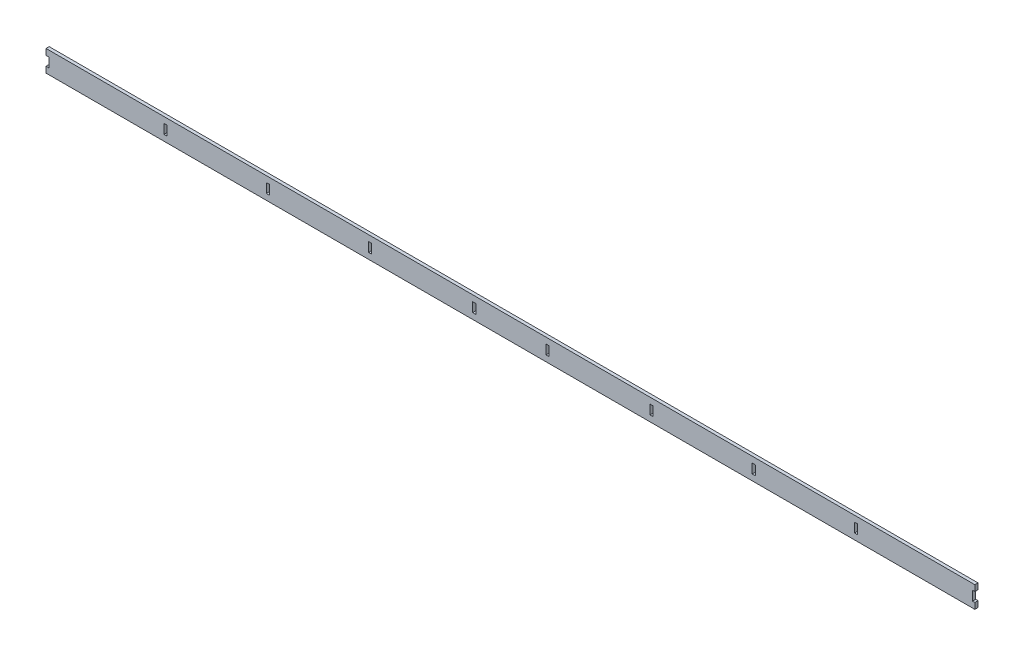
from build123d import *

# Parameters (mm, degrees)
EXTRUDE_1_DEPTH = 2


with BuildPart() as part:
    # Model → 凸台-拉伸1 (new body)
    with BuildSketch(Plane.XY):
        Polygon((587.364408917, 20.936416671), (-2.931829291, 20.936416671), (-2.931829291, 17.136416671), (-0.931829291, 17.136416671), (-0.931829291, 11.136416671), (-2.931829291, 11.136416671), (-2.931829291, 7.336416671), (587.364408917, 7.336416671), (587.364408917, 11.136416671), (585.864408917, 11.136416671), (585.864408917, 17.136416671), (587.364408917, 17.136416671), align=None)
        Polygon((72.06814754, 14.136416671), (72.06814754, 17.136416671), (74.06814754, 17.136416671), (74.06814754, 11.136416671), (72.06814754, 11.136416671), align=None, mode=Mode.SUBTRACT)
        Polygon((137.068124371, 14.136416671), (137.068123187, 17.136422392), (139.068123187, 17.136422392), (139.068123187, 11.136422392), (137.068123187, 11.136422392), align=None, mode=Mode.SUBTRACT)
        Polygon((202.068101203, 14.136416671), (202.068100018, 17.136422392), (204.068100018, 17.136422392), (204.068100018, 11.136422392), (202.068100018, 11.136422392), align=None, mode=Mode.SUBTRACT)
        Polygon((268.268078197, 14.136421579), (268.268077012, 17.136427299), (270.268077012, 17.136427299), (270.268077012, 11.136427299), (268.268077012, 11.136427299), align=None, mode=Mode.SUBTRACT)
        Polygon((314.768088309, 14.136421579), (314.768087125, 17.136427299), (316.768087125, 17.136427299), (316.768087125, 11.136427299), (314.768087125, 11.136427299), align=None, mode=Mode.SUBTRACT)
        Polygon((380.864480518, 14.136421579), (380.864479333, 17.136427299), (382.864479333, 17.136427299), (382.864479333, 11.136427299), (380.864479333, 11.136427299), align=None, mode=Mode.SUBTRACT)
        Polygon((445.864457349, 14.136421579), (445.864456165, 17.136427299), (447.864456165, 17.136427299), (447.864456165, 11.136427299), (445.864456165, 11.136427299), align=None, mode=Mode.SUBTRACT)
        Polygon((510.86443418, 14.136421579), (510.864432996, 17.136427299), (512.864432996, 17.136427299), (512.864432996, 11.136427299), (510.864432996, 11.136427299), align=None, mode=Mode.SUBTRACT)
    extrude(amount=EXTRUDE_1_DEPTH)


solid = part.part
